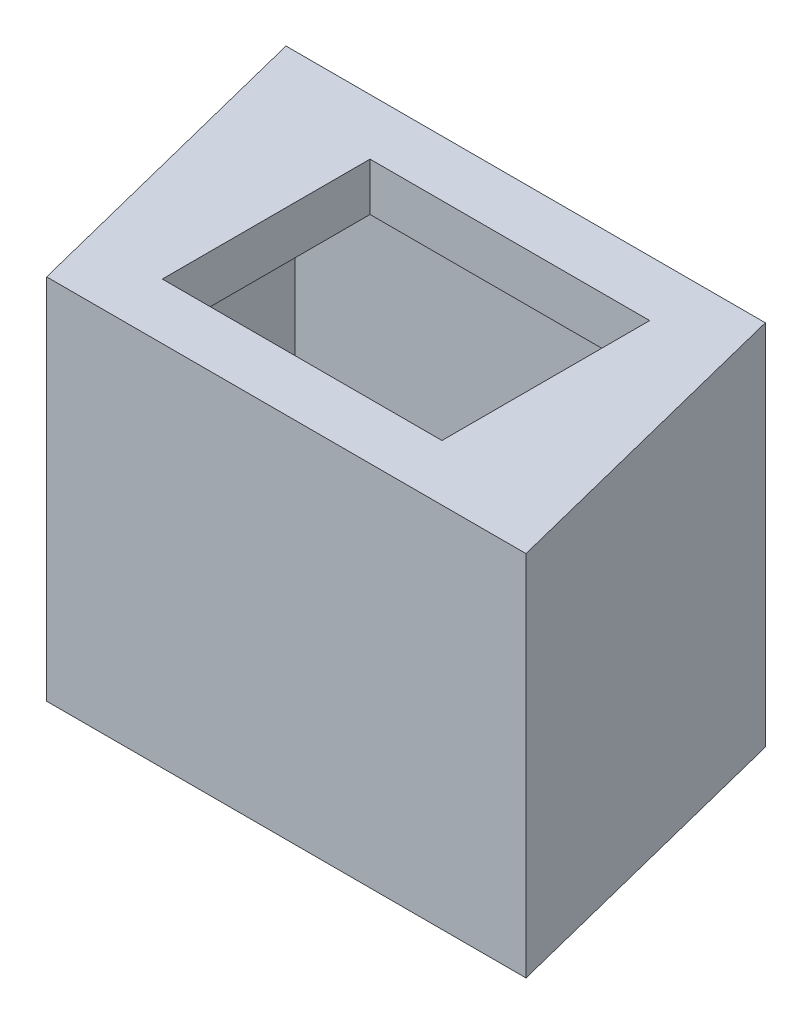
from build123d import *

# Parameters (mm, degrees)
EXTRUDE_1_DEPTH     = 3
SKETCH_2_W          = 17.5
SKETCH_2_H          = 13
CUT_EXTRUDE_1_DEPTH = 41.443247314
EXTRUDE_2_DEPTH     = 20


with BuildPart() as part:
    # Эскиз1 → Бобышка-Вытянуть1 (new body)
    with BuildSketch(Plane(origin=(0, 0, 0), x_dir=(1, 0, 0), z_dir=(0, 1, 0))):
        Polygon((0, 0), (30, 0), (35.02365277, -20), (5.02365277, -20), align=None)
    extrude(amount=EXTRUDE_1_DEPTH)

    # Эскиз2 → Вырез-Вытянуть1 (cut, through all)
    with BuildSketch(Plane(origin=(0, 3, 0), x_dir=(1, 0, 0), z_dir=(0, 1, 0))):
        with Locations((17.511826385, -10)):
            Rectangle(SKETCH_2_W, SKETCH_2_H)
    extrude(amount=-CUT_EXTRUDE_1_DEPTH, mode=Mode.SUBTRACT)

    # Эскиз3 → Бобышка-Вытянуть2 (add)
    with BuildSketch(Plane.XZ):
        Polygon((5.02365277, 20), (0, 0), (30, 0), (35.02365277, 20), align=None)
        Polygon((6.583415246, 18), (2.56449303, 2), (28.440237524, 2), (32.459159739, 18), align=None, mode=Mode.SUBTRACT)
    extrude(amount=EXTRUDE_2_DEPTH)


solid = part.part
